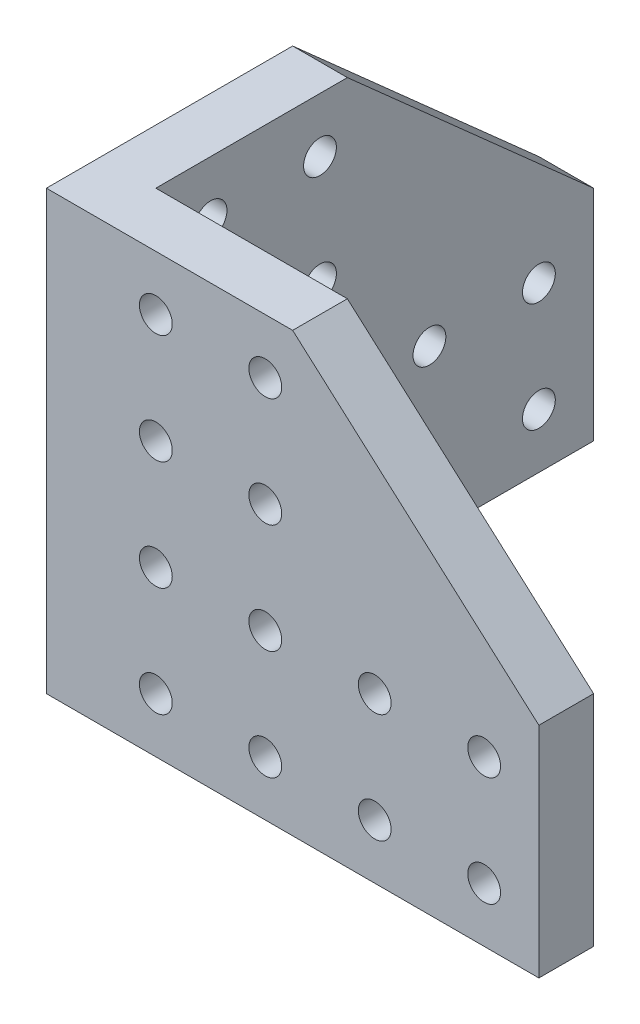
from build123d import *

# Parameters (mm, degrees)
BOSS_EXTRUDE1_DEPTH = 80
CUT_EXTRUDE1_REACH  = 152.333
CUT_EXTRUDE2_REACH  = 152.333
CUT_EXTRUDE3_REACH  = 152.333
SKETCH4_R           = 3
CUT_EXTRUDE4_REACH  = 152.333
SKETCH5_R           = 2.5
SKETCH5_R_2         = 3


with BuildPart() as part:
    # Sketch1 → Boss-Extrude1 (new body)
    with BuildSketch(Plane(origin=(0, 0, 0), x_dir=(1, 0, 0), z_dir=(0, 1, 0))):
        Polygon((0, 0), (90, 0), (90, 10), (10, 10), (10, 90), (0, 90), align=None)
    extrude(amount=BOSS_EXTRUDE1_DEPTH)

    # Sketch2 → Cut-Extrude1 (cut, up to next)
    with BuildSketch(Plane.XY, mode=Mode.PRIVATE) as cut_extrude1_sk1:
        Polygon((45, 80), (90, 40), (90, 80), align=None)
    cut_extrude1_tool1 = extrude(cut_extrude1_sk1.sketch, amount=-CUT_EXTRUDE1_REACH, mode=Mode.PRIVATE) & part.part
    add(cut_extrude1_tool1.solids().sort_by_distance((75, 66.666667, 0))[0], mode=Mode.SUBTRACT)

    # Sketch3 → Cut-Extrude2 (cut, up to next)
    with BuildSketch(Plane.ZY, mode=Mode.PRIVATE) as cut_extrude2_sk1:
        Polygon((-45, 80), (-90, 40), (-90, 80), align=None)
    cut_extrude2_tool1 = extrude(cut_extrude2_sk1.sketch, amount=-CUT_EXTRUDE2_REACH, mode=Mode.PRIVATE) & part.part
    add(cut_extrude2_tool1.solids().sort_by_distance((0, 66.666667, -75))[0], mode=Mode.SUBTRACT)

    # Sketch4 → Cut-Extrude3 (cut, up to next)
    with BuildSketch(Plane.XY, mode=Mode.PRIVATE) as cut_extrude3_sk1:
        with Locations((20, 70)):
            Circle(SKETCH4_R)
    cut_extrude3_tool1 = extrude(cut_extrude3_sk1.sketch, amount=-CUT_EXTRUDE3_REACH, mode=Mode.PRIVATE) & part.part
    # Sketch4 → Cut-Extrude3 (cut, up to next)
    with BuildSketch(Plane.XY, mode=Mode.PRIVATE) as cut_extrude3_sk2:
        with Locations((40, 70)):
            Circle(SKETCH4_R)
    cut_extrude3_tool2 = extrude(cut_extrude3_sk2.sketch, amount=-CUT_EXTRUDE3_REACH, mode=Mode.PRIVATE) & part.part
    # Sketch4 → Cut-Extrude3 (cut, up to next)
    with BuildSketch(Plane.XY, mode=Mode.PRIVATE) as cut_extrude3_sk3:
        with Locations((40, 50)):
            Circle(SKETCH4_R)
    cut_extrude3_tool3 = extrude(cut_extrude3_sk3.sketch, amount=-CUT_EXTRUDE3_REACH, mode=Mode.PRIVATE) & part.part
    # Sketch4 → Cut-Extrude3 (cut, up to next)
    with BuildSketch(Plane.XY, mode=Mode.PRIVATE) as cut_extrude3_sk4:
        with Locations((20, 30)):
            Circle(SKETCH4_R)
    cut_extrude3_tool4 = extrude(cut_extrude3_sk4.sketch, amount=-CUT_EXTRUDE3_REACH, mode=Mode.PRIVATE) & part.part
    # Sketch4 → Cut-Extrude3 (cut, up to next)
    with BuildSketch(Plane.XY, mode=Mode.PRIVATE) as cut_extrude3_sk5:
        with Locations((40, 10)):
            Circle(SKETCH4_R)
    cut_extrude3_tool5 = extrude(cut_extrude3_sk5.sketch, amount=-CUT_EXTRUDE3_REACH, mode=Mode.PRIVATE) & part.part
    # Sketch4 → Cut-Extrude3 (cut, up to next)
    with BuildSketch(Plane.XY, mode=Mode.PRIVATE) as cut_extrude3_sk6:
        with Locations((20, 50)):
            Circle(SKETCH4_R)
    cut_extrude3_tool6 = extrude(cut_extrude3_sk6.sketch, amount=-CUT_EXTRUDE3_REACH, mode=Mode.PRIVATE) & part.part
    # Sketch4 → Cut-Extrude3 (cut, up to next)
    with BuildSketch(Plane.XY, mode=Mode.PRIVATE) as cut_extrude3_sk7:
        with Locations((40, 30)):
            Circle(SKETCH4_R)
    cut_extrude3_tool7 = extrude(cut_extrude3_sk7.sketch, amount=-CUT_EXTRUDE3_REACH, mode=Mode.PRIVATE) & part.part
    # Sketch4 → Cut-Extrude3 (cut, up to next)
    with BuildSketch(Plane.XY, mode=Mode.PRIVATE) as cut_extrude3_sk8:
        with Locations((20, 10)):
            Circle(SKETCH4_R)
    cut_extrude3_tool8 = extrude(cut_extrude3_sk8.sketch, amount=-CUT_EXTRUDE3_REACH, mode=Mode.PRIVATE) & part.part
    # Sketch4 → Cut-Extrude3 (cut, up to next)
    with BuildSketch(Plane.XY, mode=Mode.PRIVATE) as cut_extrude3_sk9:
        with Locations((60, 30)):
            Circle(SKETCH4_R)
    cut_extrude3_tool9 = extrude(cut_extrude3_sk9.sketch, amount=-CUT_EXTRUDE3_REACH, mode=Mode.PRIVATE) & part.part
    # Sketch4 → Cut-Extrude3 (cut, up to next)
    with BuildSketch(Plane.XY, mode=Mode.PRIVATE) as cut_extrude3_sk10:
        with Locations((80, 10)):
            Circle(SKETCH4_R)
    cut_extrude3_tool10 = extrude(cut_extrude3_sk10.sketch, amount=-CUT_EXTRUDE3_REACH, mode=Mode.PRIVATE) & part.part
    # Sketch4 → Cut-Extrude3 (cut, up to next)
    with BuildSketch(Plane.XY, mode=Mode.PRIVATE) as cut_extrude3_sk11:
        with Locations((80, 30)):
            Circle(SKETCH4_R)
    cut_extrude3_tool11 = extrude(cut_extrude3_sk11.sketch, amount=-CUT_EXTRUDE3_REACH, mode=Mode.PRIVATE) & part.part
    # Sketch4 → Cut-Extrude3 (cut, up to next)
    with BuildSketch(Plane.XY, mode=Mode.PRIVATE) as cut_extrude3_sk12:
        with Locations((60, 10)):
            Circle(SKETCH4_R)
    cut_extrude3_tool12 = extrude(cut_extrude3_sk12.sketch, amount=-CUT_EXTRUDE3_REACH, mode=Mode.PRIVATE) & part.part
    add(cut_extrude3_tool1.solids().sort_by_distance((20, 70, 0))[0], mode=Mode.SUBTRACT)
    add(cut_extrude3_tool2.solids().sort_by_distance((40, 70, 0))[0], mode=Mode.SUBTRACT)
    add(cut_extrude3_tool3.solids().sort_by_distance((40, 50, 0))[0], mode=Mode.SUBTRACT)
    add(cut_extrude3_tool4.solids().sort_by_distance((20, 30, 0))[0], mode=Mode.SUBTRACT)
    add(cut_extrude3_tool5.solids().sort_by_distance((40, 10, 0))[0], mode=Mode.SUBTRACT)
    add(cut_extrude3_tool6.solids().sort_by_distance((20, 50, 0))[0], mode=Mode.SUBTRACT)
    add(cut_extrude3_tool7.solids().sort_by_distance((40, 30, 0))[0], mode=Mode.SUBTRACT)
    add(cut_extrude3_tool8.solids().sort_by_distance((20, 10, 0))[0], mode=Mode.SUBTRACT)
    add(cut_extrude3_tool9.solids().sort_by_distance((60, 30, 0))[0], mode=Mode.SUBTRACT)
    add(cut_extrude3_tool10.solids().sort_by_distance((80, 10, 0))[0], mode=Mode.SUBTRACT)
    add(cut_extrude3_tool11.solids().sort_by_distance((80, 30, 0))[0], mode=Mode.SUBTRACT)
    add(cut_extrude3_tool12.solids().sort_by_distance((60, 10, 0))[0], mode=Mode.SUBTRACT)

    # Sketch5 → Cut-Extrude4 (cut, up to next)
    with BuildSketch(Plane.ZY, mode=Mode.PRIVATE) as cut_extrude4_sk1:
        with Locations((-20, 30)):
            Circle(SKETCH5_R)
    cut_extrude4_tool1 = extrude(cut_extrude4_sk1.sketch, amount=-CUT_EXTRUDE4_REACH, mode=Mode.PRIVATE) & part.part
    # Sketch5 → Cut-Extrude4 (cut, up to next)
    with BuildSketch(Plane.ZY, mode=Mode.PRIVATE) as cut_extrude4_sk2:
        with Locations((-40, 30)):
            Circle(SKETCH5_R)
    cut_extrude4_tool2 = extrude(cut_extrude4_sk2.sketch, amount=-CUT_EXTRUDE4_REACH, mode=Mode.PRIVATE) & part.part
    # Sketch5 → Cut-Extrude4 (cut, up to next)
    with BuildSketch(Plane.ZY, mode=Mode.PRIVATE) as cut_extrude4_sk3:
        with Locations((-40, 10)):
            Circle(SKETCH5_R)
    cut_extrude4_tool3 = extrude(cut_extrude4_sk3.sketch, amount=-CUT_EXTRUDE4_REACH, mode=Mode.PRIVATE) & part.part
    # Sketch5 → Cut-Extrude4 (cut, up to next)
    with BuildSketch(Plane.ZY, mode=Mode.PRIVATE) as cut_extrude4_sk4:
        with Locations((-20, 10)):
            Circle(SKETCH5_R)
    cut_extrude4_tool4 = extrude(cut_extrude4_sk4.sketch, amount=-CUT_EXTRUDE4_REACH, mode=Mode.PRIVATE) & part.part
    # Sketch5 → Cut-Extrude4 (cut, up to next)
    with BuildSketch(Plane.ZY, mode=Mode.PRIVATE) as cut_extrude4_sk5:
        with Locations((-20, 70)):
            Circle(SKETCH5_R_2)
    cut_extrude4_tool5 = extrude(cut_extrude4_sk5.sketch, amount=-CUT_EXTRUDE4_REACH, mode=Mode.PRIVATE) & part.part
    # Sketch5 → Cut-Extrude4 (cut, up to next)
    with BuildSketch(Plane.ZY, mode=Mode.PRIVATE) as cut_extrude4_sk6:
        with Locations((-40, 70)):
            Circle(SKETCH5_R_2)
    cut_extrude4_tool6 = extrude(cut_extrude4_sk6.sketch, amount=-CUT_EXTRUDE4_REACH, mode=Mode.PRIVATE) & part.part
    # Sketch5 → Cut-Extrude4 (cut, up to next)
    with BuildSketch(Plane.ZY, mode=Mode.PRIVATE) as cut_extrude4_sk7:
        with Locations((-40, 50)):
            Circle(SKETCH5_R_2)
    cut_extrude4_tool7 = extrude(cut_extrude4_sk7.sketch, amount=-CUT_EXTRUDE4_REACH, mode=Mode.PRIVATE) & part.part
    # Sketch5 → Cut-Extrude4 (cut, up to next)
    with BuildSketch(Plane.ZY, mode=Mode.PRIVATE) as cut_extrude4_sk8:
        with Locations((-20, 50)):
            Circle(SKETCH5_R_2)
    cut_extrude4_tool8 = extrude(cut_extrude4_sk8.sketch, amount=-CUT_EXTRUDE4_REACH, mode=Mode.PRIVATE) & part.part
    # Sketch5 → Cut-Extrude4 (cut, up to next)
    with BuildSketch(Plane.ZY, mode=Mode.PRIVATE) as cut_extrude4_sk9:
        with Locations((-60, 30)):
            Circle(SKETCH5_R_2)
    cut_extrude4_tool9 = extrude(cut_extrude4_sk9.sketch, amount=-CUT_EXTRUDE4_REACH, mode=Mode.PRIVATE) & part.part
    # Sketch5 → Cut-Extrude4 (cut, up to next)
    with BuildSketch(Plane.ZY, mode=Mode.PRIVATE) as cut_extrude4_sk10:
        with Locations((-80, 30)):
            Circle(SKETCH5_R_2)
    cut_extrude4_tool10 = extrude(cut_extrude4_sk10.sketch, amount=-CUT_EXTRUDE4_REACH, mode=Mode.PRIVATE) & part.part
    # Sketch5 → Cut-Extrude4 (cut, up to next)
    with BuildSketch(Plane.ZY, mode=Mode.PRIVATE) as cut_extrude4_sk11:
        with Locations((-80, 10)):
            Circle(SKETCH5_R_2)
    cut_extrude4_tool11 = extrude(cut_extrude4_sk11.sketch, amount=-CUT_EXTRUDE4_REACH, mode=Mode.PRIVATE) & part.part
    # Sketch5 → Cut-Extrude4 (cut, up to next)
    with BuildSketch(Plane.ZY, mode=Mode.PRIVATE) as cut_extrude4_sk12:
        with Locations((-60, 10)):
            Circle(SKETCH5_R_2)
    cut_extrude4_tool12 = extrude(cut_extrude4_sk12.sketch, amount=-CUT_EXTRUDE4_REACH, mode=Mode.PRIVATE) & part.part
    add(cut_extrude4_tool1.solids().sort_by_distance((0, 30, -20))[0], mode=Mode.SUBTRACT)
    add(cut_extrude4_tool2.solids().sort_by_distance((0, 30, -40))[0], mode=Mode.SUBTRACT)
    add(cut_extrude4_tool3.solids().sort_by_distance((0, 10, -40))[0], mode=Mode.SUBTRACT)
    add(cut_extrude4_tool4.solids().sort_by_distance((0, 10, -20))[0], mode=Mode.SUBTRACT)
    add(cut_extrude4_tool5.solids().sort_by_distance((0, 70, -20))[0], mode=Mode.SUBTRACT)
    add(cut_extrude4_tool6.solids().sort_by_distance((0, 70, -40))[0], mode=Mode.SUBTRACT)
    add(cut_extrude4_tool7.solids().sort_by_distance((0, 50, -40))[0], mode=Mode.SUBTRACT)
    add(cut_extrude4_tool8.solids().sort_by_distance((0, 50, -20))[0], mode=Mode.SUBTRACT)
    add(cut_extrude4_tool9.solids().sort_by_distance((0, 30, -60))[0], mode=Mode.SUBTRACT)
    add(cut_extrude4_tool10.solids().sort_by_distance((0, 30, -80))[0], mode=Mode.SUBTRACT)
    add(cut_extrude4_tool11.solids().sort_by_distance((0, 10, -80))[0], mode=Mode.SUBTRACT)
    add(cut_extrude4_tool12.solids().sort_by_distance((0, 10, -60))[0], mode=Mode.SUBTRACT)


solid = part.part
